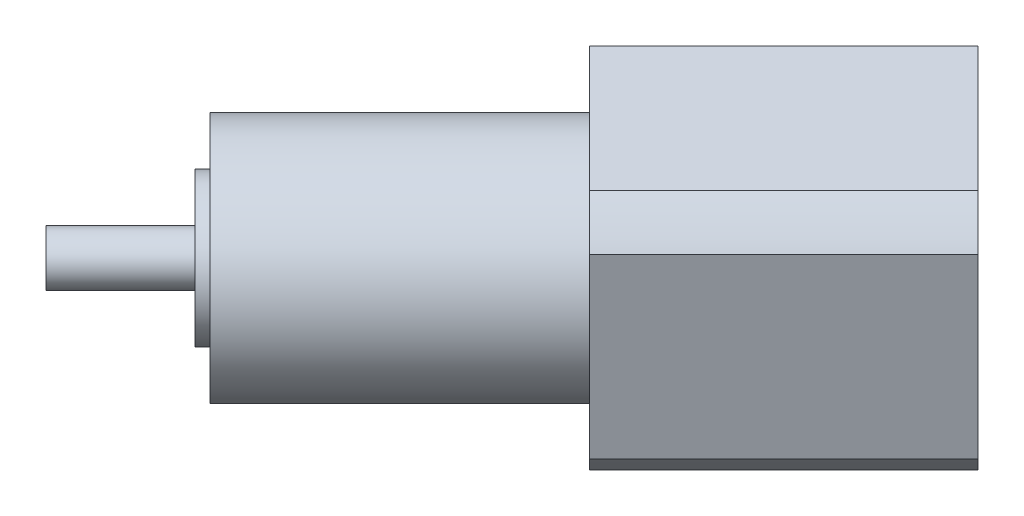
from build123d import *

# Parameters (mm, degrees)
BOSS_EXTRU_1_DEPTH                = 48
DIAM_TRE_DU_PER_AGE_3_0_3_1_D     = 3
DIAM_TRE_DU_PER_AGE_3_0_3_1_DEPTH = 10
DIAM_TRE_DU_PER_AGE_2_0_2_1_D     = 2
DIAM_TRE_DU_PER_AGE_2_0_2_1_DEPTH = 9.000001526
DIAM_TRE_DU_PER_AGE_3_0_3_2_D     = 3
DIAM_TRE_DU_PER_AGE_3_0_3_2_DEPTH = 9.000001526


with BuildPart() as part:
    # Esquisse1 → Boss.-Extru.1 (new body)
    with BuildSketch(Plane(origin=(79.448008992, 0, -79.44794681), x_dir=(0, 1, 0), z_dir=(0.7071070579059934, 0, -0.7071065044669933))):
        with BuildLine():
            Line((188.763426925, 171.056630761), (157.836573075, 171.056630761))
            ThreePointArc((157.836573075, 171.056630761), (154.773801793, 168.43282973), (152.150000763, 165.370058448))
            Line((152.150000763, 165.370058448), (152.150000763, 134.443204599))
            ThreePointArc((152.150000763, 134.443204599), (154.77380225, 131.38043286), (157.836574119, 128.756631524))
            Line((157.836574119, 128.756631524), (188.763425881, 128.756631524))
            ThreePointArc((188.763425881, 128.756631524), (191.826198207, 131.380433317), (194.45, 134.443205643))
            Line((194.45, 134.443205643), (194.45, 165.370057405))
            ThreePointArc((194.45, 165.370057405), (191.826198664, 168.432829273), (188.763426925, 171.056630761))
        make_face()
    extrude(amount=-BOSS_EXTRU_1_DEPTH)

    # Esquisse2 → Révolution1 (revolve)
    with BuildSketch(Plane(origin=(0, 173.3, 0), x_dir=(1, 0, 0), z_dir=(0, 1, 0))):
        Polygon((164.213527842, -73.19991591), (151.506824443, -60.493202565), (103.989230421, -108.010759396), (106.817656439, -110.839187627), (119.828426035, -97.828428215), (124.778171566, -102.77817762), (126.12167388, -101.434676357), (131.050205731, -106.363212066), align=None)
    revolve(axis=Axis((132.687188584, 173.3, 79.312823694), (-0.7071070579059953, 0, 0.7071065044669914)))

    # Diamètre du perçage Ø3.0 (3)1
    with Locations(Plane(origin=(45.506870213, 0, -45.506834595), x_dir=(0.7071065044669932, 0, 0.7071070579059936), z_dir=(-0.7071070579059936, 0, 0.7071065044669932))):
        with Locations((134.406631524, 188.8), (134.406631524, 157.8), (165.406631524, 188.8), (165.406631524, 157.8)):
            Hole(DIAM_TRE_DU_PER_AGE_3_0_3_1_D / 2, depth=DIAM_TRE_DU_PER_AGE_3_0_3_1_DEPTH)

    # Diamètre du perçage Ø2.0 (2)1
    with Locations(Plane(origin=(12.343548118, 0, -12.343538457), x_dir=(0.7071065044669916, 0, 0.7071070579059952), z_dir=(-0.7071070579059952, 0, 0.7071065044669916))):
        with Locations((149.906631524, 159.2), (164.006631524, 173.3), (135.806631524, 173.3), (149.906631524, 187.4)):
            Hole(DIAM_TRE_DU_PER_AGE_2_0_2_1_D / 2, depth=DIAM_TRE_DU_PER_AGE_2_0_2_1_DEPTH)

    # Diamètre du perçage Ø3.0 (3)2
    with Locations(Plane(origin=(12.343548118, 0, -12.343538457), x_dir=(0.7071065044669916, 0, 0.7071070579059952), z_dir=(-0.7071070579059952, 0, 0.7071065044669916))):
        with Locations((139.906631524, 163.3), (139.906631524, 183.3), (159.906631524, 183.3), (159.906631524, 163.3)):
            Hole(DIAM_TRE_DU_PER_AGE_3_0_3_2_D / 2, depth=DIAM_TRE_DU_PER_AGE_3_0_3_2_DEPTH)


solid = part.part
